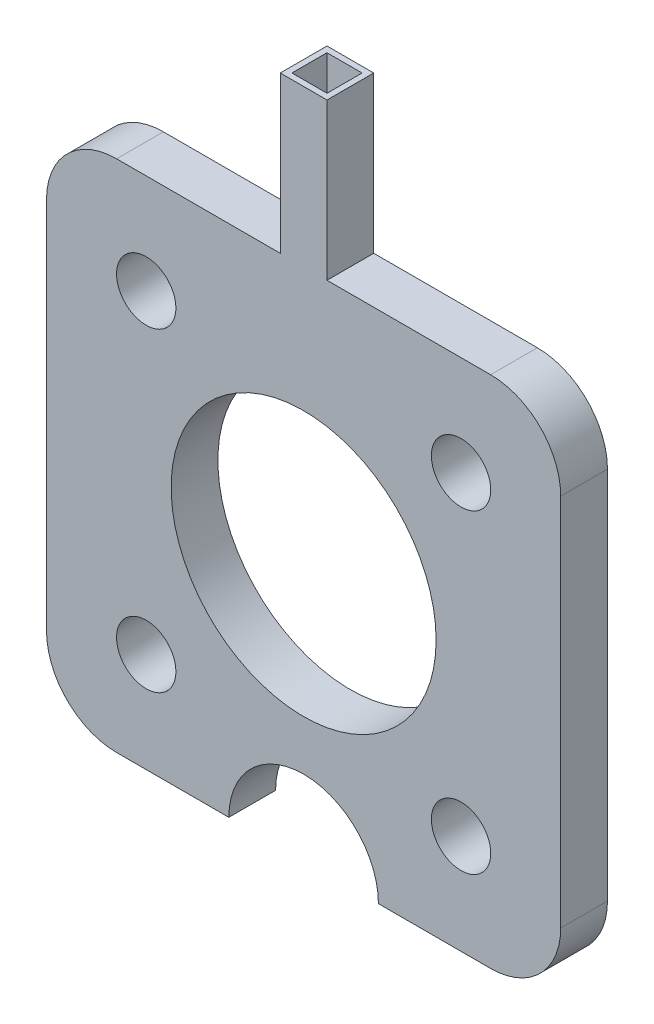
from build123d import *

# Parameters (mm, degrees)
SKETCH1_W           = 22
SKETCH1_H           = 22
BOSS_EXTRUDE1_DEPTH = 2
FILLET1_R           = 3
SKETCH2_R           = 1.27
CUT_EXTRUDE1_DEPTH  = 32.176914536
CUT_EXTRUDE2_DEPTH  = 32.176914536
SKETCH4_R           = 5.66890013
CUT_EXTRUDE3_DEPTH  = 10
SKETCH5_W           = 2
SKETCH5_H           = 2
BOSS_EXTRUDE2_DEPTH = 6.68
SKETCH6_W           = 1.502554682
SKETCH6_H           = 1.5
CUT_EXTRUDE4_DEPTH  = 6.8


with BuildPart() as part:
    # Sketch1 → Boss-Extrude1 (new body)
    with BuildSketch(Plane.XY):
        with Locations((11, -11)):
            Rectangle(SKETCH1_W, SKETCH1_H)
    extrude(amount=BOSS_EXTRUDE1_DEPTH)

    # Fillet1
    fillet1_edges = [part.edges().sort_by_distance(p)[0] for p in [
        (0, 0, 1),
        (22, 0, 1),
        (22, -22, 1),
        (0, -22, 1),
    ]]
    fillet(fillet1_edges, radius=FILLET1_R)

    # Sketch2 → Cut-Extrude1 (cut, through all)
    with BuildSketch(Plane.XY.offset(2)):
        with Locations((4.265, -4.265)):
            Circle(SKETCH2_R)
        with Locations((4.265, -17.735)):
            Circle(SKETCH2_R)
        with Locations((17.735, -4.265)):
            Circle(SKETCH2_R)
        with Locations((17.735, -17.735)):
            Circle(SKETCH2_R)
    extrude(amount=-CUT_EXTRUDE1_DEPTH, mode=Mode.SUBTRACT)

    # Sketch3 → Cut-Extrude2 (cut, through all)
    with BuildSketch(Plane.XY.offset(2)):
        with BuildLine():
            Line((7.8, -22), (14.2, -22))
            ThreePointArc((14.2, -22), (11, -18.8), (7.8, -22))
        make_face()
    extrude(amount=-CUT_EXTRUDE2_DEPTH, mode=Mode.SUBTRACT)

    # Sketch4 → Cut-Extrude3 (cut)
    with BuildSketch(Plane.XY.offset(2)):
        with Locations((11, -11)):
            Circle(SKETCH4_R)
    extrude(amount=-CUT_EXTRUDE3_DEPTH, mode=Mode.SUBTRACT)

    # Sketch5 → Boss-Extrude2 (add)
    with BuildSketch(Plane(origin=(0, 0, 0), x_dir=(1, 0, 0), z_dir=(0, 1, 0))):
        with Locations((11, -1)):
            Rectangle(SKETCH5_W, SKETCH5_H)
    extrude(amount=BOSS_EXTRUDE2_DEPTH)

    # Sketch6 → Cut-Extrude4 (cut)
    with BuildSketch(Plane(origin=(0, 6.68, 0), x_dir=(1, 0, 0), z_dir=(0, 1, 0))):
        with Locations((11, -1)):
            Rectangle(SKETCH6_W, SKETCH6_H)
    extrude(amount=-CUT_EXTRUDE4_DEPTH, mode=Mode.SUBTRACT)


solid = part.part
